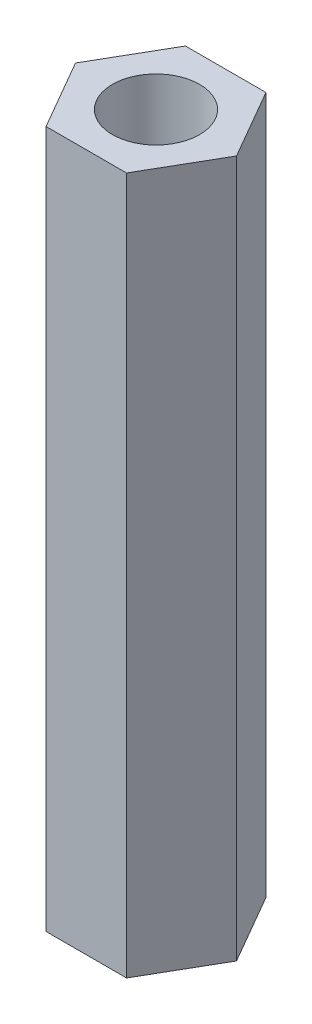
from build123d import *

# Parameters (mm, degrees)
BOSS_EXTRUDE1_DEPTH   = 20
M3X0_5_TAPPED_HOLE1_D = 2.5


with BuildPart() as part:
    # Sketch1 → Boss-Extrude1 (new body)
    with BuildSketch(Plane(origin=(0, 0, 0), x_dir=(1, 0, 0), z_dir=(0, 1, 0))):
        Polygon((2.309401077, 0), (1.154700538, 2), (-1.154700538, 2), (-2.309401077, 0), (-1.154700538, -2), (1.154700538, -2), align=None)
    extrude(amount=BOSS_EXTRUDE1_DEPTH)

    # M3x0.5 Tapped Hole1 (through all)
    with Locations(Plane(origin=(0, 0, 0), x_dir=(-1, 0, 0), z_dir=(0, -1, 0))):
        with Locations((0, 0)):
            Hole(M3X0_5_TAPPED_HOLE1_D / 2)


solid = part.part
